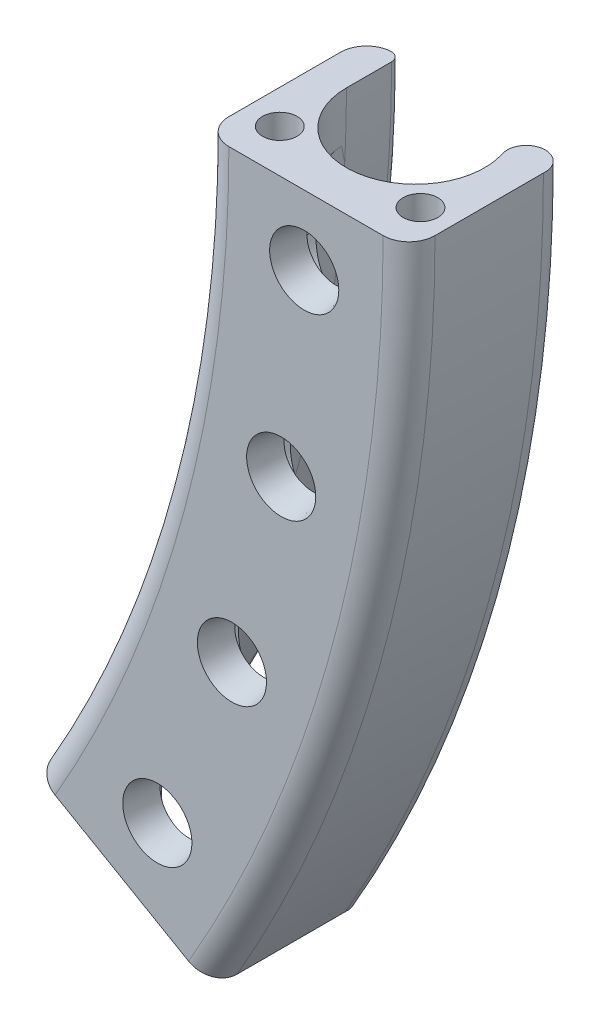
from build123d import *

# Parameters (mm, degrees)
SKETCH2_R                   = 2
SKETCH4_R                   = 4
CUT_EXTRUDE1_DEPTH          = 10
CUT_EXTRUDE1_DRAFT          = -10
CUT_EXTRUDE4_DEPTH          = 9
CIRPATTERN1_COUNT           = 4
CIRPATTERN1_ANGLE           = 24
CIRPATTERN1_COPY_1_SKETCH_R = 4
CIRPATTERN1_COPY_1_DEPTH    = 10
CIRPATTERN1_COPY_1_DRAFT    = -10
CIRPATTERN1_COPY_2_SKETCH_R = 4
CIRPATTERN1_COPY_2_DEPTH    = 10
CIRPATTERN1_COPY_2_DRAFT    = -10
CIRPATTERN1_COPY_3_SKETCH_R = 4
CIRPATTERN1_COPY_3_DEPTH    = 10
CIRPATTERN1_COPY_3_DRAFT    = -10
FILLET1_R                   = 1


with BuildPart() as part:
    # Sweep1: sweep along a path in Sketch3
    with BuildLine(Plane.XY) as sweep1_path:
        ThreePointArc((159, 0), (153.58220638, -41.152228171), (137.698039202, -79.5))
    # Sketch2 → Sweep1 (sweep)
    with BuildSketch(Plane(origin=(0, 0, 0), x_dir=(1, 0, 0), z_dir=(0, 1, 0))):
        with BuildLine():
            Line((150.08376977, -12.675230973), (167.925264394, -12.675230973))
            ThreePointArc((167.925264394, -12.675230973), (170.046584738, -11.796551317), (170.925264394, -9.675230973))
            Line((170.925264394, -9.675230973), (170.925264394, 2.871500395))
            ThreePointArc((170.925264394, 2.871500395), (168.497710858, 5.279451612), (166.625787596, 2.418132243))
            ThreePointArc((166.625787596, 2.418132243), (160.223458057, -7.905893396), (151, 0))
            Line((151, 0), (151, 6.240044562))
            Line((151, 6.240044562), (150.08376977, 6.240044562))
            ThreePointArc((150.08376977, 6.240044562), (147.962449426, 5.361364905), (147.08376977, 3.240044562))
            Line((147.08376977, 3.240044562), (147.08376977, -9.675230973))
            ThreePointArc((147.08376977, -9.675230973), (147.962449426, -11.796551317), (150.08376977, -12.675230973))
        make_face()
        with Locations((167.277911718, -7.70558532)):
            Circle(SKETCH2_R, mode=Mode.SUBTRACT)
        with Locations((151, -7.70558532)):
            Circle(SKETCH2_R, mode=Mode.SUBTRACT)
    sweep(path=sweep1_path.line)


with BuildPart() as cut_extrude1_tool:
    # Sketch4 → Cut-Extrude1 (with draft: the straight prism first)
    with BuildSketch(Plane.XY.offset(12.675230973)):
        with Locations((158.796951183, -8.032950582)):
            Circle(SKETCH4_R)
    extrude(amount=-CUT_EXTRUDE1_DEPTH)
    # Cut-Extrude1: the draft: its side faces are tilted about the plane it starts from
    cut_extrude1_sides = [cut_extrude1_tool.faces().sort_by_distance(p)[0] for p in [
        (154.796951183, -8.032950582, 7.675230973),
    ]]
    draft(cut_extrude1_sides, Plane.XY.offset(12.675230973), CUT_EXTRUDE1_DRAFT)


with BuildPart() as part_1:
    add(part.part)

    # Cut-Extrude1: cut by cut_extrude1_tool
    add(cut_extrude1_tool.part, mode=Mode.SUBTRACT)

    # Sketch5 → Cut-Extrude4 (cut)
    with BuildSketch(Plane.XY):
        with BuildLine():
            ThreePointArc((153.661985467, -9.778309602), (158.52294767, -13.449506046), (163.729571689, -10.287591563))
            Line((163.729571689, -10.287591563), (153.661985467, -9.778309602))
        make_face()
        with BuildLine():
            Line((153.864330676, -5.778309602), (163.931916898, -6.287591563))
            ThreePointArc((163.931916898, -6.287591563), (159.070954695, -2.616395119), (153.864330676, -5.778309602))
        make_face()
        with BuildLine():
            Line((150.705994871, -9.628776968), (153.661985467, -9.778309602))
            ThreePointArc((153.661985467, -9.778309602), (153.38039572, -7.75894707), (153.864330676, -5.778309602))
            Line((153.864330676, -5.778309602), (150.90834008, -5.628776968))
            Line((150.90834008, -5.628776968), (150.705994871, -9.628776968))
        make_face()
        with BuildLine():
            Line((153.661985467, -9.778309602), (163.729571689, -10.287591563))
            ThreePointArc((163.729571689, -10.287591563), (164.096296747, -9.186678281), (164.22043263, -8.032950582))
            ThreePointArc((164.22043263, -8.032950582), (164.147817575, -7.148428192), (163.931916898, -6.287591563))
            Line((163.931916898, -6.287591563), (153.864330676, -5.778309602))
            ThreePointArc((153.864330676, -5.778309602), (153.38039572, -7.75894707), (153.661985467, -9.778309602))
        make_face()
        with BuildLine():
            Line((163.729571689, -10.287591563), (166.685562285, -10.437124197))
            Line((166.685562285, -10.437124197), (166.887907495, -6.437124197))
            Line((166.887907495, -6.437124197), (163.931916898, -6.287591563))
            ThreePointArc((163.931916898, -6.287591563), (164.147817575, -7.148428192), (164.22043263, -8.032950582))
            ThreePointArc((164.22043263, -8.032950582), (164.096296747, -9.186678281), (163.729571689, -10.287591563))
        make_face()
    cut_extrude4 = extrude(amount=CUT_EXTRUDE4_DEPTH, mode=Mode.SUBTRACT)

    # CirPattern1: Cut-Extrude4 ×4 about axis
    cirpattern1_axis = Axis((0, 0, 0), (0, 0, -1))
    for i in range(1, CIRPATTERN1_COUNT):
        add(cut_extrude4.rotate(cirpattern1_axis, i * CIRPATTERN1_ANGLE / (CIRPATTERN1_COUNT - 1)), mode=Mode.SUBTRACT)


with BuildPart() as cirpattern1_copy_1_tool:
    # CirPattern1 copy 1 sketch → CirPattern1 copy 1 (with draft: the straight prism first)
    with BuildSketch(Plane(origin=(0, 0, 12.675230973), x_dir=(0.9902680687415703, -0.13917310096006605, 0), z_dir=(0, 0, 1))):
        with Locations((158.796951183, -8.032950582)):
            Circle(CIRPATTERN1_COPY_1_SKETCH_R)
    extrude(amount=-CIRPATTERN1_COPY_1_DEPTH)
    # CirPattern1 copy 1: the draft: its side faces are tilted about the plane it starts from
    cirpattern1_copy_1_sides = [cirpattern1_copy_1_tool.faces().sort_by_distance(p)[0] for p in [
        (152.172507253, -29.498346174, 7.675230973),
    ]]
    draft(cirpattern1_copy_1_sides, Plane(origin=(0, 0, 12.675230973), x_dir=(0.9902680687415703, -0.13917310096006605, 0), z_dir=(0, 0, 1)), CIRPATTERN1_COPY_1_DRAFT)


with BuildPart() as part_2:
    add(part_1.part)

    # CirPattern1 copy 1: cut by cirpattern1_copy_1_tool
    add(cirpattern1_copy_1_tool.part, mode=Mode.SUBTRACT)


with BuildPart() as cirpattern1_copy_2_tool:
    # CirPattern1 copy 2 sketch → CirPattern1 copy 2 (with draft: the straight prism first)
    with BuildSketch(Plane(origin=(0, 0, 12.675230973), x_dir=(0.9612616959383186, -0.27563735581700033, 0), z_dir=(0, 0, 1))):
        with Locations((158.796951183, -8.032950582)):
            Circle(CIRPATTERN1_COPY_2_SKETCH_R)
    extrude(amount=-CIRPATTERN1_COPY_2_DEPTH)
    # CirPattern1 copy 2: the draft: its side faces are tilted about the plane it starts from
    cirpattern1_copy_2_sides = [cirpattern1_copy_2_tool.faces().sort_by_distance(p)[0] for p in [
        (146.586198562, -50.389590012, 7.675230973),
    ]]
    draft(cirpattern1_copy_2_sides, Plane(origin=(0, 0, 12.675230973), x_dir=(0.9612616959383186, -0.27563735581700033, 0), z_dir=(0, 0, 1)), CIRPATTERN1_COPY_2_DRAFT)


with BuildPart() as part_3:
    add(part_2.part)

    # CirPattern1 copy 2: cut by cirpattern1_copy_2_tool
    add(cirpattern1_copy_2_tool.part, mode=Mode.SUBTRACT)


with BuildPart() as cirpattern1_copy_3_tool:
    # CirPattern1 copy 3 sketch → CirPattern1 copy 3 (with draft: the straight prism first)
    with BuildSketch(Plane(origin=(0, 0, 12.675230973), x_dir=(0.9135454576426001, -0.4067366430758019, 0), z_dir=(0, 0, 1))):
        with Locations((158.796951183, -8.032950582)):
            Circle(CIRPATTERN1_COPY_3_SKETCH_R)
    extrude(amount=-CIRPATTERN1_COPY_3_DEPTH)
    # CirPattern1 copy 3: the draft: its side faces are tilted about the plane it starts from
    cirpattern1_copy_3_sides = [cirpattern1_copy_3_tool.faces().sort_by_distance(p)[0] for p in [
        (138.146756256, -70.300057798, 7.675230973),
    ]]
    draft(cirpattern1_copy_3_sides, Plane(origin=(0, 0, 12.675230973), x_dir=(0.9135454576426001, -0.4067366430758019, 0), z_dir=(0, 0, 1)), CIRPATTERN1_COPY_3_DRAFT)


with BuildPart() as part_4:
    add(part_3.part)

    # CirPattern1 copy 3: cut by cirpattern1_copy_3_tool
    add(cirpattern1_copy_3_tool.part, mode=Mode.SUBTRACT)

    # Fillet1
    fillet1_edges = [part_4.edges().sort_by_distance(p)[0] for p in [
        (145.85479977, -39.08167581, -6.240044562),
    ]]
    fillet(fillet1_edges, radius=FILLET1_R)


solid = part_4.part
